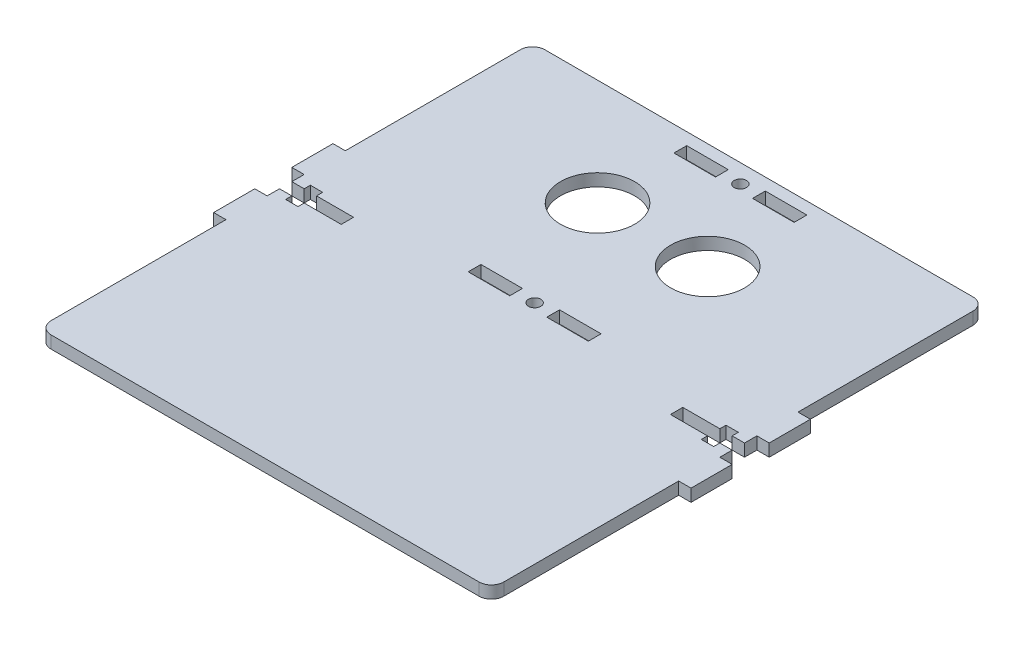
from build123d import *

# Parameters (mm, degrees)
SKETCH1_W           = 10.1
SKETCH1_H           = 3.1
SKETCH1_R           = 1.5
BOSS_EXTRUDE1_DEPTH = 3
FILLET1_R           = 3
SKETCH2_R           = 9
CUT_EXTRUDE1_DEPTH  = 10


with BuildPart() as part:
    # Sketch1 → Boss-Extrude1 (new body)
    with BuildSketch(Plane(origin=(0, 0, 0), x_dir=(1, 0, 0), z_dir=(0, 1, 0))):
        Polygon((0, 45.5), (0, 0), (110, 0), (110, 45.5), (113, 45.5), (113, 55.5), (110, 55.5), (110, 58.5), (107, 58.5), (107, 57), (104, 57), (104, 58.5), (95, 58.5), (95, 61.5), (104, 61.5), (104, 63), (107, 63), (107, 61.5), (110, 61.5), (110, 64.5), (113, 64.5), (113, 74.5), (110, 74.5), (110, 120), (0, 120), (0, 74.5), (-3, 74.5), (-3, 64.5), (0, 64.5), (0, 61.5), (3, 61.5), (3, 63), (6, 63), (6, 61.5), (15, 61.5), (15, 58.5), (6, 58.5), (6, 57), (3, 57), (3, 58.5), (0, 58.5), (0, 55.5), (-3, 55.5), (-3, 45.5), align=None)
        with Locations((45.45, 65.5)):
            Rectangle(SKETCH1_W, SKETCH1_H, mode=Mode.SUBTRACT)
        with Locations((45.45, 115.5)):
            Rectangle(SKETCH1_W, SKETCH1_H, mode=Mode.SUBTRACT)
        with Locations(Location((55, 65.5, 0), (0, 0, 270))):
            Circle(SKETCH1_R, mode=Mode.SUBTRACT)
        with Locations((64.55, 65.5)):
            Rectangle(SKETCH1_W, SKETCH1_H, mode=Mode.SUBTRACT)
        with Locations(Location((55, 115.5, 0), (0, 0, 270))):
            Circle(SKETCH1_R, mode=Mode.SUBTRACT)
        with Locations((64.55, 115.5)):
            Rectangle(SKETCH1_W, SKETCH1_H, mode=Mode.SUBTRACT)
    extrude(amount=BOSS_EXTRUDE1_DEPTH)

    # Fillet1
    fillet1_edges = [part.edges().sort_by_distance(p)[0] for p in [
        (110, 1.5, 0),
        (0, 1.5, 0),
        (0, 1.5, -120),
        (110, 1.5, -120),
    ]]
    fillet(fillet1_edges, radius=FILLET1_R)

    # Sketch2 → Cut-Extrude1 (cut)
    with BuildSketch(Plane(origin=(0, 3, 0), x_dir=(1, 0, 0), z_dir=(0, 1, 0))):
        with Locations(Location((41.625, 94.16, 0), (0, 0, 270))):
            Circle(SKETCH2_R)
        with Locations(Location((68.375, 94.16, 0), (0, 0, 270))):
            Circle(SKETCH2_R)
    extrude(amount=-CUT_EXTRUDE1_DEPTH, mode=Mode.SUBTRACT)


solid = part.part
